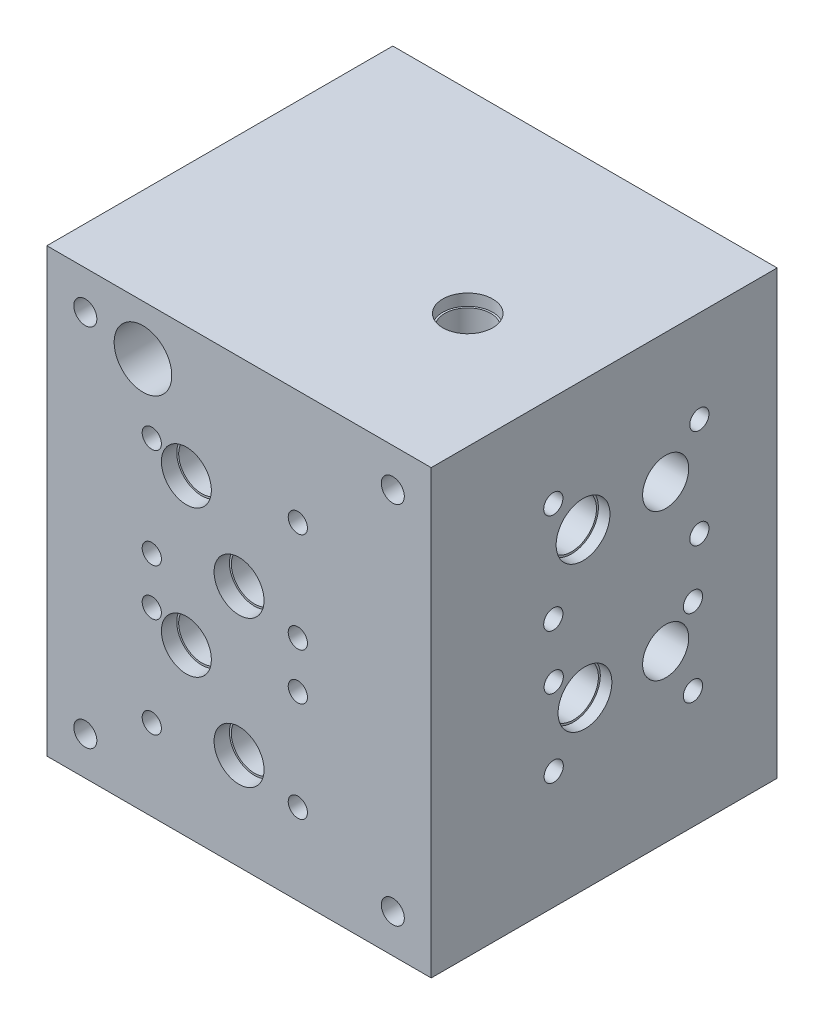
from build123d import *

# Parameters (mm, degrees)
SKETCH_1_W                    = 200
SKETCH_1_H                    = 200
EXTRUDE_1_DEPTH               = 180
HOLE_WIZARD_M14_1_D           = 12
HOLE_WIZARD_M14_2_D           = 24
HOLE_WIZARD_M14_2_DEPTH       = 60.789672572
HOLE_WIZARD_M14_2_CBORE_D     = 26
HOLE_WIZARD_M14_2_CBORE_DEPTH = 8
HOLE_WIZARD_M14_2_TIP         = 7.210327428
HOLE_WIZARD_M16_2_D           = 22
HOLE_WIZARD_M16_2_DEPTH       = 33.390533191
HOLE_WIZARD_M16_2_CBORE_D     = 24
HOLE_WIZARD_M16_2_CBORE_DEPTH = 6
HOLE_WIZARD_M16_2_TIP         = 6.609466809
HOLE_WIZARD_M12_1_D           = 10.2
HOLE_WIZARD_M12_1_DEPTH       = 16.935610843
HOLE_WIZARD_M12_1_TIP         = 3.064389157
HOLE_WIZARD_M16_3_D           = 24
HOLE_WIZARD_M16_3_DEPTH       = 136.789672572
HOLE_WIZARD_M16_3_CBORE_D     = 26
HOLE_WIZARD_M16_3_CBORE_DEPTH = 6
HOLE_WIZARD_M16_3_TIP         = 7.210327428
HOLE_WIZARD_M12_2_D           = 10
HOLE_WIZARD_M12_2_DEPTH       = 16.995696905
HOLE_WIZARD_M12_2_TIP         = 3.004303095
HOLE_WIZARD_M14_3_D           = 24
HOLE_WIZARD_M14_3_DEPTH       = 90.789672572
HOLE_WIZARD_M14_3_CBORE_D     = 26
HOLE_WIZARD_M14_3_CBORE_DEPTH = 8
HOLE_WIZARD_M14_3_TIP         = 7.210327428
HOLE_WIZARD_M14_4_D           = 24
HOLE_WIZARD_M14_4_DEPTH       = 70.789672572
HOLE_WIZARD_M14_4_CBORE_D     = 26
HOLE_WIZARD_M14_4_CBORE_DEPTH = 8
HOLE_WIZARD_M14_4_TIP         = 7.210327428
HOLE_WIZARD_M16_4_D           = 24
HOLE_WIZARD_M16_4_DEPTH       = 82.789672572
HOLE_WIZARD_M16_4_CBORE_D     = 26
HOLE_WIZARD_M16_4_CBORE_DEPTH = 6
HOLE_WIZARD_M16_4_TIP         = 7.210327428
SKETCH_48_W                   = 200
SKETCH_48_H                   = 180
EXTRUDE_3_DEPTH               = 30
HOLE_WIZARD_M14_2_2_D         = 12
HOLE_WIZARD_M14_6_D           = 30
HOLE_WIZARD_M14_6_CBORE_D     = 34
HOLE_WIZARD_M14_6_CBORE_DEPTH = 14
HOLE_WIZARD_M16_5_D           = 24
HOLE_WIZARD_M16_5_CBORE_D     = 26
HOLE_WIZARD_M16_5_CBORE_DEPTH = 6
HOLE_WIZARD_M16_6_D           = 26
HOLE_WIZARD_M16_6_DEPTH       = 72.188811953
HOLE_WIZARD_M16_6_CBORE_D     = 28
HOLE_WIZARD_M16_6_CBORE_DEPTH = 6
HOLE_WIZARD_M16_6_TIP         = 7.811188047
HOLE_WIZARD_M12_3_D           = 10
HOLE_WIZARD_M12_3_DEPTH       = 29.745696905
HOLE_WIZARD_M12_3_TIP         = 3.004303095
HOLE_WIZARD_M16_7_D           = 24
HOLE_WIZARD_M16_7_DEPTH       = 156.789672572
HOLE_WIZARD_M16_7_CBORE_D     = 26
HOLE_WIZARD_M16_7_CBORE_DEPTH = 6
HOLE_WIZARD_M16_7_TIP         = 7.210327428


with BuildPart() as part:
    # 草图1 → 凸台-拉伸1 (new body)
    with BuildSketch(Plane.XY):
        Rectangle(SKETCH_1_W, SKETCH_1_H)
    extrude(amount=EXTRUDE_1_DEPTH)

    # M14 螺纹孔1 (through all)
    with Locations(Plane(origin=(0, 0, 0), x_dir=(-1, 0, 0), z_dir=(0, 0, -1))):
        with Locations((-80, 110), (80, 110), (80, -80), (-80, -80)):
            Hole(HOLE_WIZARD_M14_1_D / 2)

    # Hole Wizard M14 _2
    with Locations(Plane(origin=(0, 0, 0), x_dir=(-1, 0, 0), z_dir=(0, 0, -1))):
        with Locations((0, -70)):
            CounterBoreHole(HOLE_WIZARD_M14_2_D / 2, HOLE_WIZARD_M14_2_CBORE_D / 2, HOLE_WIZARD_M14_2_CBORE_DEPTH, depth=HOLE_WIZARD_M14_2_DEPTH)
            with Locations((0, 0, -(HOLE_WIZARD_M14_2_DEPTH + HOLE_WIZARD_M14_2_TIP / 2))):  # 118° drill point
                Cone(0, HOLE_WIZARD_M14_2_D / 2, HOLE_WIZARD_M14_2_TIP, mode=Mode.SUBTRACT)

    # M16 六角头螺栓的柱形沉头孔2
    with Locations(Plane(origin=(0, -100, 0), x_dir=(-1, 0, 0), z_dir=(0, -1, 0))):
        with Locations((0, -49.3090365)):
            CounterBoreHole(HOLE_WIZARD_M16_2_D / 2, HOLE_WIZARD_M16_2_CBORE_D / 2, HOLE_WIZARD_M16_2_CBORE_DEPTH, depth=HOLE_WIZARD_M16_2_DEPTH)
            with Locations((0, 0, -(HOLE_WIZARD_M16_2_DEPTH + HOLE_WIZARD_M16_2_TIP / 2))):  # 118° drill point
                Cone(0, HOLE_WIZARD_M16_2_D / 2, HOLE_WIZARD_M16_2_TIP, mode=Mode.SUBTRACT)

    # M12 螺纹孔1
    with Locations(Plane(origin=(0, -100, 0), x_dir=(-1, 0, 0), z_dir=(0, -1, 0))):
        with Locations((-52, -80), (52, -80), (52, -35), (-52, -35)):
            Hole(HOLE_WIZARD_M12_1_D / 2, depth=HOLE_WIZARD_M12_1_DEPTH)
            with Locations((0, 0, -(HOLE_WIZARD_M12_1_DEPTH + HOLE_WIZARD_M12_1_TIP / 2))):  # 118° drill point
                Cone(0, HOLE_WIZARD_M12_1_D / 2, HOLE_WIZARD_M12_1_TIP, mode=Mode.SUBTRACT)

    # M16 六角头螺栓的柱形沉头孔3
    with Locations(Plane(origin=(0, -100, 0), x_dir=(-1, 0, 0), z_dir=(0, -1, 0))):
        with Locations((0, -89.3090365)):
            CounterBoreHole(HOLE_WIZARD_M16_3_D / 2, HOLE_WIZARD_M16_3_CBORE_D / 2, HOLE_WIZARD_M16_3_CBORE_DEPTH, depth=HOLE_WIZARD_M16_3_DEPTH)
            with Locations((0, 0, -(HOLE_WIZARD_M16_3_DEPTH + HOLE_WIZARD_M16_3_TIP / 2))):  # 118° drill point
                Cone(0, HOLE_WIZARD_M16_3_D / 2, HOLE_WIZARD_M16_3_TIP, mode=Mode.SUBTRACT)

    # M12 螺纹孔2
    with Locations(Plane.XY.offset(180)):
        with Locations((-45.405185199, 70.567635323), (30.594814801, 70.567635323), (30.594814801, 18.567635323), (-45.405185199, 18.567635323), (-45.405185199, -5.70646009), (-45.405185199, -57.70646009), (30.594814801, -5.70646009), (30.594814801, -57.70646009)):
            Hole(HOLE_WIZARD_M12_2_D / 2, depth=HOLE_WIZARD_M12_2_DEPTH)
            with Locations((0, 0, -(HOLE_WIZARD_M12_2_DEPTH + HOLE_WIZARD_M12_2_TIP / 2))):  # 118° drill point
                Cone(0, HOLE_WIZARD_M12_2_D / 2, HOLE_WIZARD_M12_2_TIP, mode=Mode.SUBTRACT)

    # M14 六角头螺栓的柱形沉头孔3
    with Locations(Plane.XY.offset(180)):
        with Locations((0, -49.70646009), (0, 26.567635323)):
            CounterBoreHole(HOLE_WIZARD_M14_3_D / 2, HOLE_WIZARD_M14_3_CBORE_D / 2, HOLE_WIZARD_M14_3_CBORE_DEPTH, depth=HOLE_WIZARD_M14_3_DEPTH)
            with Locations((0, 0, -(HOLE_WIZARD_M14_3_DEPTH + HOLE_WIZARD_M14_3_TIP / 2))):  # 118° drill point
                Cone(0, HOLE_WIZARD_M14_3_D / 2, HOLE_WIZARD_M14_3_TIP, mode=Mode.SUBTRACT)

    # M14 六角头螺栓的柱形沉头孔4
    with Locations(Plane.XY.offset(180)):
        with Locations((-27.405185199, 62.567635323), (-27.405185199, -13.70646009)):
            CounterBoreHole(HOLE_WIZARD_M14_4_D / 2, HOLE_WIZARD_M14_4_CBORE_D / 2, HOLE_WIZARD_M14_4_CBORE_DEPTH, depth=HOLE_WIZARD_M14_4_DEPTH)
            with Locations((0, 0, -(HOLE_WIZARD_M14_4_DEPTH + HOLE_WIZARD_M14_4_TIP / 2))):  # 118° drill point
                Cone(0, HOLE_WIZARD_M14_4_D / 2, HOLE_WIZARD_M14_4_TIP, mode=Mode.SUBTRACT)

    # M16 六角头螺栓的柱形沉头孔4
    with Locations(Plane.ZY.offset(100)):
        with Locations((113, 62.567635323), (113, -13.70646009)):
            CounterBoreHole(HOLE_WIZARD_M16_4_D / 2, HOLE_WIZARD_M16_4_CBORE_D / 2, HOLE_WIZARD_M16_4_CBORE_DEPTH, depth=HOLE_WIZARD_M16_4_DEPTH)
            with Locations((0, 0, -(HOLE_WIZARD_M16_4_DEPTH + HOLE_WIZARD_M16_4_TIP / 2))):  # 118° drill point
                Cone(0, HOLE_WIZARD_M16_4_D / 2, HOLE_WIZARD_M16_4_TIP, mode=Mode.SUBTRACT)

    # 草图48 → 凸台-拉伸3 (add)
    with BuildSketch(Plane(origin=(0, 100, 0), x_dir=(1, 0, 0), z_dir=(0, 1, 0))):
        with Locations((0, -90)):
            Rectangle(SKETCH_48_W, SKETCH_48_H)
    extrude(amount=EXTRUDE_3_DEPTH)

    # Hole Wizard M14 _2 2 (through all)
    with Locations(Plane(origin=(0, 0, 0), x_dir=(-1, 0, 0), z_dir=(0, 0, -1))):
        with Locations((-80, 110), (80, 110)):
            Hole(HOLE_WIZARD_M14_2_2_D / 2)

    # M14 六角头螺栓的柱形沉头孔6 (through all)
    with Locations(Plane(origin=(0, 0, 0), x_dir=(-1, 0, 0), z_dir=(0, 0, -1))):
        with Locations((50, 104)):
            CounterBoreHole(HOLE_WIZARD_M14_6_D / 2, HOLE_WIZARD_M14_6_CBORE_D / 2, HOLE_WIZARD_M14_6_CBORE_DEPTH)

    # M16 六角头螺栓的柱形沉头孔5 (through all)
    with Locations(Plane.ZY.offset(100)):
        with Locations((58, 62.567635323), (58, -13.70646009)):
            CounterBoreHole(HOLE_WIZARD_M16_5_D / 2, HOLE_WIZARD_M16_5_CBORE_D / 2, HOLE_WIZARD_M16_5_CBORE_DEPTH)

    # M16 六角头螺栓的柱形沉头孔6
    with Locations(Plane(origin=(100, 0, 0), x_dir=(0, 0, -1), z_dir=(1, 0, 0))):
        with Locations((-101, 62.567635323), (-100, -13.70646009)):
            CounterBoreHole(HOLE_WIZARD_M16_6_D / 2, HOLE_WIZARD_M16_6_CBORE_D / 2, HOLE_WIZARD_M16_6_CBORE_DEPTH, depth=HOLE_WIZARD_M16_6_DEPTH)
            with Locations((0, 0, -(HOLE_WIZARD_M16_6_DEPTH + HOLE_WIZARD_M16_6_TIP / 2))):  # 118° drill point
                Cone(0, HOLE_WIZARD_M16_6_D / 2, HOLE_WIZARD_M16_6_TIP, mode=Mode.SUBTRACT)

    # M12 螺纹孔3
    with Locations(Plane(origin=(100, 0, 0), x_dir=(0, 0, -1), z_dir=(1, 0, 0))):
        with Locations((-116.464807502, 30), (-116.464807502, 82), (-40.464807502, 82), (-40.464807502, 30.494906485), (-43.788877513, -38.693936587), (-116.25532641, -38.693936587), (-116.25532641, 1.556465636), (-43.788877513, 1.556465636)):
            Hole(HOLE_WIZARD_M12_3_D / 2, depth=HOLE_WIZARD_M12_3_DEPTH)
            with Locations((0, 0, -(HOLE_WIZARD_M12_3_DEPTH + HOLE_WIZARD_M12_3_TIP / 2))):  # 118° drill point
                Cone(0, HOLE_WIZARD_M12_3_D / 2, HOLE_WIZARD_M12_3_TIP, mode=Mode.SUBTRACT)

    # M16 六角头螺栓的柱形沉头孔7
    with Locations(Plane(origin=(0, 130, 0), x_dir=(1, 0, 0), z_dir=(0, 1, 0))):
        with Locations((40, -101)):
            CounterBoreHole(HOLE_WIZARD_M16_7_D / 2, HOLE_WIZARD_M16_7_CBORE_D / 2, HOLE_WIZARD_M16_7_CBORE_DEPTH, depth=HOLE_WIZARD_M16_7_DEPTH)
            with Locations((0, 0, -(HOLE_WIZARD_M16_7_DEPTH + HOLE_WIZARD_M16_7_TIP / 2))):  # 118° drill point
                Cone(0, HOLE_WIZARD_M16_7_D / 2, HOLE_WIZARD_M16_7_TIP, mode=Mode.SUBTRACT)


solid = part.part
